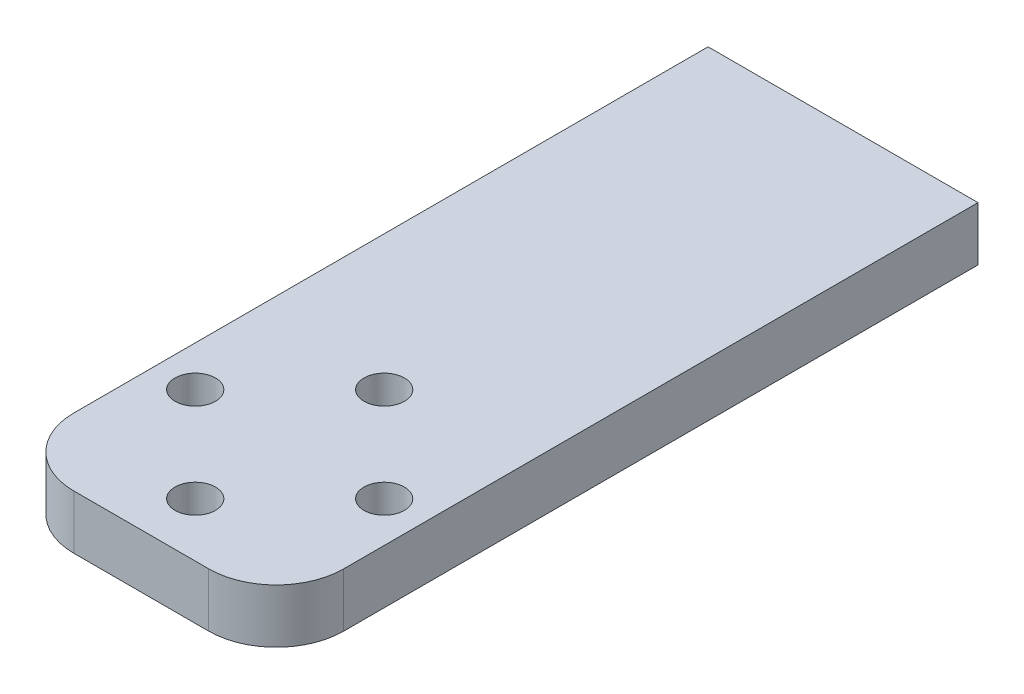
from build123d import *

# Parameters (mm, degrees)
SKETCH1_W           = 20
SKETCH1_H           = 52
SKETCH1_R           = 1.5
BOSS_EXTRUDE1_DEPTH = 4
FILLET1_R           = 5


with BuildPart() as part:
    # Sketch1 → Boss-Extrude1 (new body)
    with BuildSketch(Plane(origin=(0, 0, 0), x_dir=(1, 0, 0), z_dir=(0, 1, 0))):
        Rectangle(SKETCH1_W, SKETCH1_H)
        with Locations(Location((0, -22, 0), (0, 0, 270))):
            Circle(SKETCH1_R, mode=Mode.SUBTRACT)
        with Locations(Location((0, -8, 0), (0, 0, 270))):
            Circle(SKETCH1_R, mode=Mode.SUBTRACT)
        with Locations(Location((7, -15, 0), (0, 0, 270))):
            Circle(SKETCH1_R, mode=Mode.SUBTRACT)
        with Locations(Location((-7, -15, 0), (0, 0, 270))):
            Circle(SKETCH1_R, mode=Mode.SUBTRACT)
    extrude(amount=BOSS_EXTRUDE1_DEPTH)

    # Fillet1
    fillet1_edges = [part.edges().sort_by_distance(p)[0] for p in [
        (10, 2, 26),
        (-10, 2, 26),
    ]]
    fillet(fillet1_edges, radius=FILLET1_R)


solid = part.part
